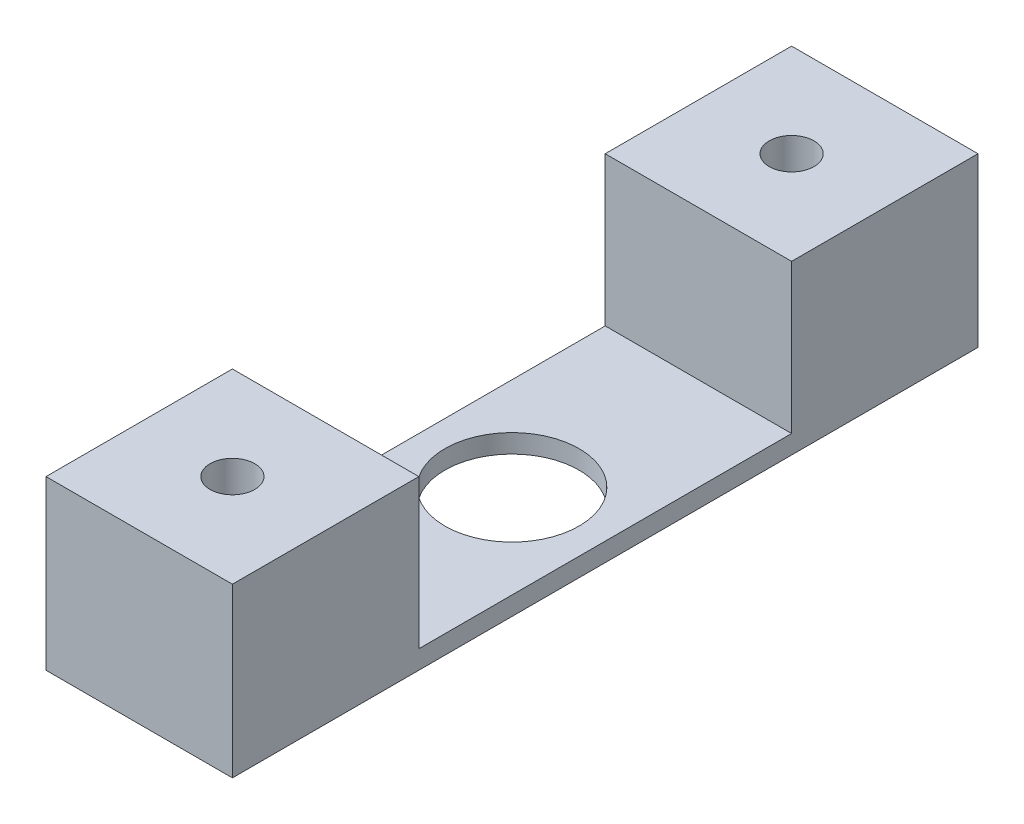
from build123d import *

# Parameters (mm, degrees)
SCHIZZO1_W                   = 10
SCHIZZO1_H                   = 40
ESTRUSIONE_ESTRUSIONE1_DEPTH = 9
SCHIZZO2_W                   = 10
SCHIZZO2_H                   = 20
TAGLIO_ESTRUSIONE1_DEPTH     = 8
FORO_PER_VITE_M2_1_D         = 2.4
FORO_PER_VITE_M2_1_DEPTH     = 6
FORO_PER_VITE_M2_1_TIP       = 0.721032743
FORO_PER_VITE_M2_2_D         = 7.2


with BuildPart() as part:
    # Schizzo1 → Estrusione-Estrusione1 (new body)
    with BuildSketch(Plane(origin=(0, 0, 0), x_dir=(1, 0, 0), z_dir=(0, 1, 0))):
        Rectangle(SCHIZZO1_W, SCHIZZO1_H)
    extrude(amount=ESTRUSIONE_ESTRUSIONE1_DEPTH)

    # Schizzo2 → Taglio-Estrusione1 (cut)
    with BuildSketch(Plane(origin=(0, 9, 0), x_dir=(1, 0, 0), z_dir=(0, 1, 0))):
        Rectangle(SCHIZZO2_W, SCHIZZO2_H)
    extrude(amount=-TAGLIO_ESTRUSIONE1_DEPTH, mode=Mode.SUBTRACT)

    # Foro per Vite M2-1
    with Locations(Plane(origin=(0, 9, 0), x_dir=(1, 0, 0), z_dir=(0, 1, 0))):
        with Locations((0, -15), (0, 15)):
            Hole(FORO_PER_VITE_M2_1_D / 2, depth=FORO_PER_VITE_M2_1_DEPTH)
            with Locations((0, 0, -(FORO_PER_VITE_M2_1_DEPTH + FORO_PER_VITE_M2_1_TIP / 2))):  # 118° drill point
                Cone(0, FORO_PER_VITE_M2_1_D / 2, FORO_PER_VITE_M2_1_TIP, mode=Mode.SUBTRACT)

    # Foro per Vite M2-2 (through all)
    with Locations(Plane(origin=(0, 1, 0), x_dir=(1, 0, 0), z_dir=(0, 1, 0))):
        with Locations((0, 0)):
            Hole(FORO_PER_VITE_M2_2_D / 2)


solid = part.part
